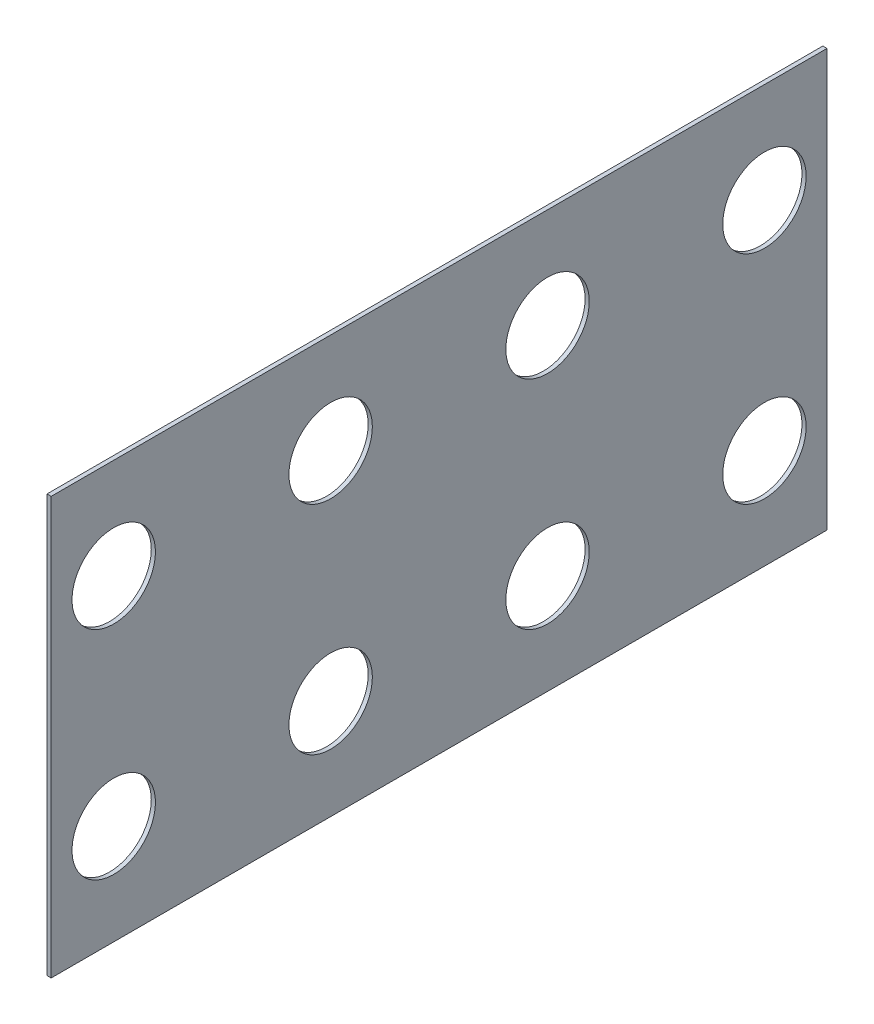
from build123d import *

# Parameters (mm, degrees)
CROQUIS1_W     = 930
CROQUIS1_H     = 500
EXTRUIR1_DEPTH = 5
CROQUIS3_R     = 50
EXTRUIR2_DEPTH = 528.967802049


with BuildPart() as part:
    # Croquis1 → Extruir1 (new body)
    with BuildSketch(Plane(origin=(0, 0, 0), x_dir=(0, 0, -1), z_dir=(1, 0, 0))):
        Rectangle(CROQUIS1_W, CROQUIS1_H)
    extrude(amount=EXTRUIR1_DEPTH)

    # Croquis3 → Extruir2 (cut, through all)
    with BuildSketch(Plane(origin=(5, 0, 0), x_dir=(0, 0, -1), z_dir=(1, 0, 0))):
        with Locations((-390, 390)):
            Circle(CROQUIS3_R)
        with Locations((-130, 390)):
            Circle(CROQUIS3_R)
        with Locations((130, 390)):
            Circle(CROQUIS3_R)
        with Locations((390, 390)):
            Circle(CROQUIS3_R)
        with Locations((-390, 130)):
            Circle(CROQUIS3_R)
        with Locations((-130, 130)):
            Circle(CROQUIS3_R)
        with Locations((130, 130)):
            Circle(CROQUIS3_R)
        with Locations((390, 130)):
            Circle(CROQUIS3_R)
        with Locations((-390, -130)):
            Circle(CROQUIS3_R)
        with Locations((-130, -130)):
            Circle(CROQUIS3_R)
        with Locations((130, -130)):
            Circle(CROQUIS3_R)
        with Locations((390, -130)):
            Circle(CROQUIS3_R)
        with Locations((-390, -390)):
            Circle(CROQUIS3_R)
        with Locations((-130, -390)):
            Circle(CROQUIS3_R)
        with Locations((130, -390)):
            Circle(CROQUIS3_R)
        with Locations((390, -390)):
            Circle(CROQUIS3_R)
    extrude(amount=-EXTRUIR2_DEPTH, mode=Mode.SUBTRACT)


solid = part.part
